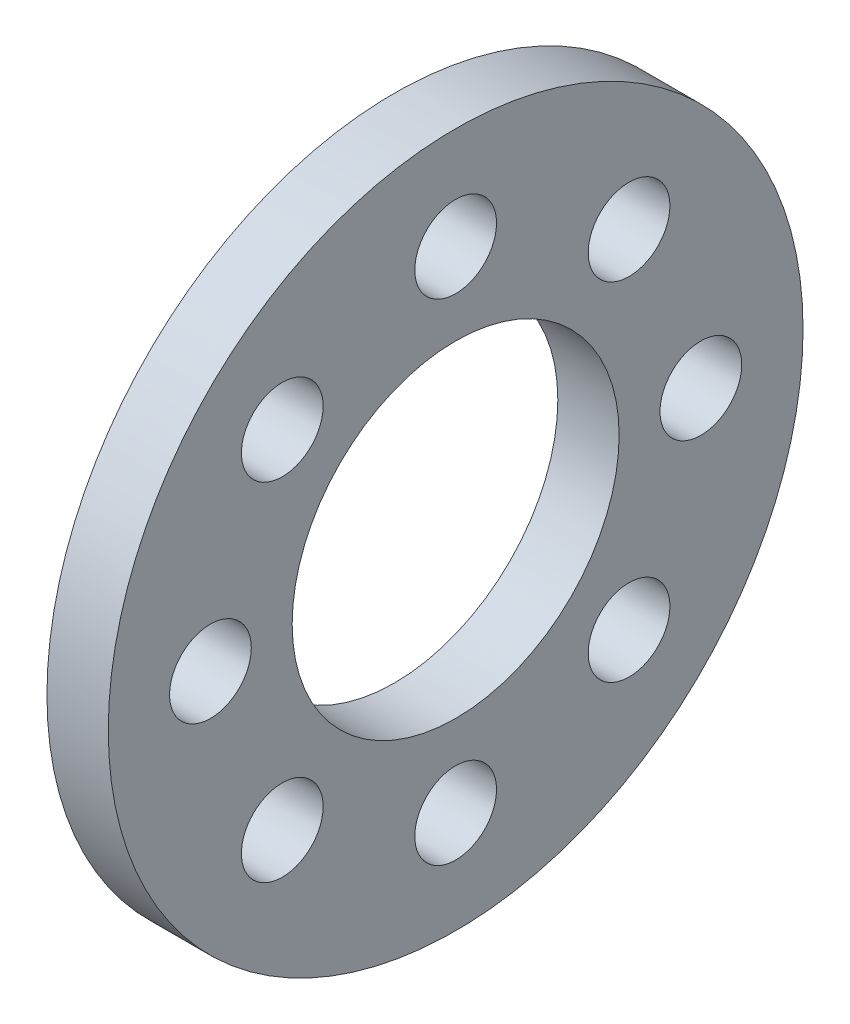
from build123d import *

# Parameters (mm, degrees)
SKETCH1_R           = 17
SKETCH1_R_2         = 2
SKETCH1_R_3         = 8
BOSS_EXTRUDE1_DEPTH = 3
SKETCH2_R           = 1.25
BOSS_EXTRUDE2_DEPTH = 3


with BuildPart() as part:
    # Sketch1 → Boss-Extrude1 (new body)
    with BuildSketch(Plane(origin=(0, 0, 0), x_dir=(0, 0, -1), z_dir=(1, 0, 0))):
        Circle(SKETCH1_R)
        with Locations((0, 12)):
            Circle(SKETCH1_R_2, mode=Mode.SUBTRACT)
        with Locations((8.485281374, 8.485281374)):
            Circle(SKETCH1_R_2, mode=Mode.SUBTRACT)
        with Locations((12, 0)):
            Circle(SKETCH1_R_2, mode=Mode.SUBTRACT)
        with Locations((8.485281374, -8.485281374)):
            Circle(SKETCH1_R_2, mode=Mode.SUBTRACT)
        with Locations((0, -12)):
            Circle(SKETCH1_R_2, mode=Mode.SUBTRACT)
        with Locations((-8.485281374, -8.485281374)):
            Circle(SKETCH1_R_2, mode=Mode.SUBTRACT)
        with Locations((-12, 0)):
            Circle(SKETCH1_R_2, mode=Mode.SUBTRACT)
        with Locations((-8.485281374, 8.485281374)):
            Circle(SKETCH1_R_2, mode=Mode.SUBTRACT)
        Circle(SKETCH1_R_3, mode=Mode.SUBTRACT)
    extrude(amount=BOSS_EXTRUDE1_DEPTH)

    # Sketch2 → Boss-Extrude2 (add)
    with BuildSketch(Plane.ZY):
        with Locations(Location((-4.818635741, 12.610739455, 0), (0, 0, 180))):
            Circle(SKETCH2_R)
        with Locations(Location((4.818635741, -12.610739455, 0), (0, 0, 180))):
            Circle(SKETCH2_R)
    extrude(amount=BOSS_EXTRUDE2_DEPTH)


solid = part.part
